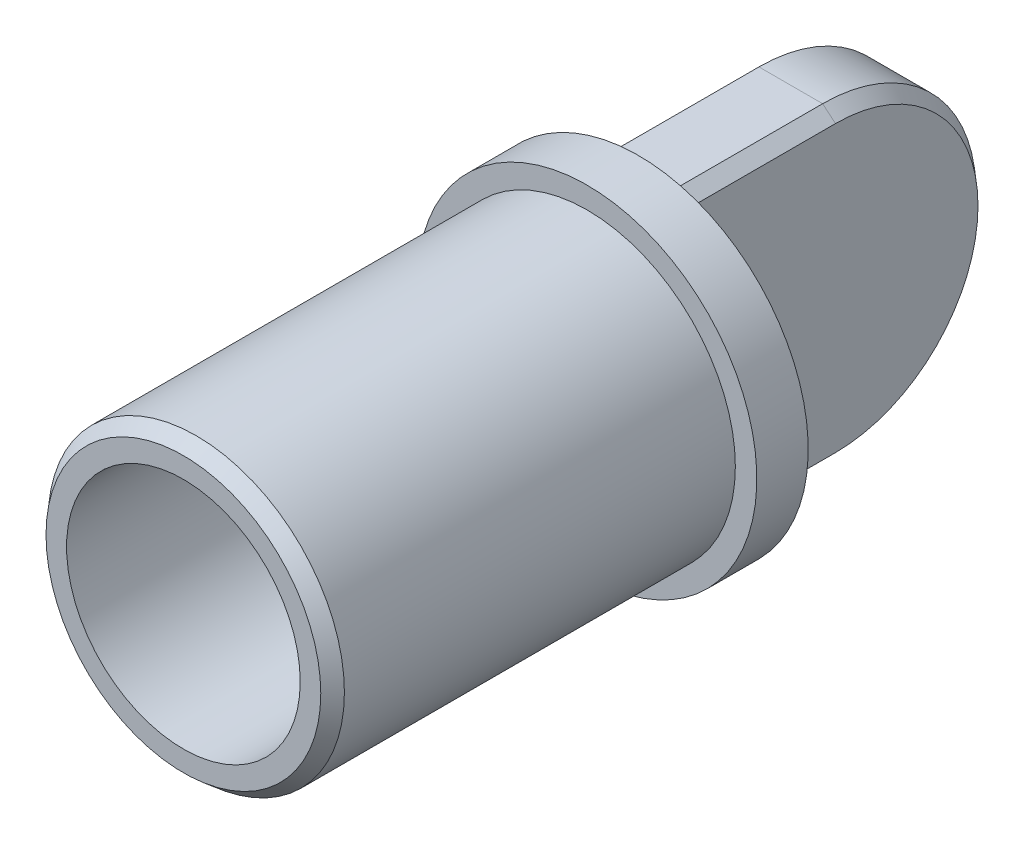
from build123d import *
from OCP.BRepFilletAPI import BRepFilletAPI_MakeChamfer

# Parameters (mm, degrees)
SKETCH1_R           = 7.325878031
EXTRUDE1_DEPTH      = 30.082981268
EXTRUDE4_DEPTH      = 32.817019656
EXTRUDE4_DEPTH_BACK = 32.817019656
SKETCH2_R           = 7.578564767
SKETCH2_5_R         = 7.578564767
EXTRUDE5_DEPTH      = 2.159
SKETCH3_R           = 8.388232563
EXTRUDE6_DEPTH      = 2.54
CHAMFER1_SIZE       = 0.635
CHAMFER1_SIZE2      = 0.532828266
CHAMFER2_SIZE       = 0.635
CHAMFER2_SIZE2      = 0.532828266
SKETCH4_R           = 5.776692344
EXTRUDE7_DEPTH      = 19.964416501


with BuildPart() as part:
    # Sketch1 → Extrude1 (new body)
    with BuildSketch(Plane.XY):
        with Locations(Location((0, 0, 0), (0, 0, 180))):
            Circle(SKETCH1_R)
    extrude(amount=EXTRUDE1_DEPTH)

    # Sketch2 → Extrude4 (cut, two sides: drawn at the far end of the back side and taken through both)
    with BuildSketch(Plane(origin=(0, 0, 0), x_dir=(0, 0, -1), z_dir=(1, 0, 0)).offset(-EXTRUDE4_DEPTH_BACK)):
        Circle(SKETCH2_R)
        with BuildLine():
            ThreePointArc((-7.578564767, 0), (-5.358854538, 5.358854538), (0, 7.578564767))
            Line((0, 7.578564767), (-7.578564767, 7.578564767))
            Line((-7.578564767, 7.578564767), (-7.578564767, 0))
        make_face()
        with BuildLine():
            ThreePointArc((0, -7.578564767), (-5.358854538, -5.358854538), (-7.578564767, 0))
            Line((-7.578564767, 0), (-7.578564767, -7.578564767))
            Line((-7.578564767, -7.578564767), (0, -7.578564767))
        make_face()
    extrude(amount=EXTRUDE4_DEPTH + EXTRUDE4_DEPTH_BACK, mode=Mode.SUBTRACT)

    # Sketch2<5> → Extrude5 (add, symmetric)
    with BuildSketch(Plane(origin=(0, 0, 0), x_dir=(0, 0, -1), z_dir=(1, 0, 0))):
        with BuildLine():
            ThreePointArc((-7.578564767, 0), (-5.358854538, 5.358854538), (0, 7.578564767))
            Line((0, 7.578564767), (-7.578564767, 7.578564767))
            Line((-7.578564767, 7.578564767), (-7.578564767, 0))
        make_face()
        Circle(SKETCH2_5_R)
        with BuildLine():
            ThreePointArc((0, -7.578564767), (-5.358854538, -5.358854538), (-7.578564767, 0))
            Line((-7.578564767, 0), (-7.578564767, -7.578564767))
            Line((-7.578564767, -7.578564767), (0, -7.578564767))
        make_face()
    extrude(amount=EXTRUDE5_DEPTH, both=True)

    # Sketch3 → Extrude6 (add)
    with BuildSketch(Plane(origin=(0, 0, 7.578564767), x_dir=(-1, 0, 0), z_dir=(0, 0, -1))):
        Circle(SKETCH3_R)
    extrude(amount=-EXTRUDE6_DEPTH)

    # Chamfer1: one chamfer whose edges measure the first distance from different faces: ONE call of the kernel's chamfer builder (chamfer() names one face for all edges)
    chamfer1_edges_1 = [part.edges().sort_by_distance(p)[0] for p in [
        (-2.159, -7.578564767, 3.789282384),
        (-2.159, 0, -7.578564767),
        (-2.159, 7.578564767, 3.789282384),
    ]]
    chamfer1_side_1 = [part.faces().sort_by_distance(p)[0] for p in [
        (-2.159, 0, 0.707457952),
    ]]
    chamfer1_edges_2 = [part.edges().sort_by_distance(p)[0] for p in [
        (2.159, -7.578564767, 3.789282384),
    ]]
    chamfer1_side_2 = [part.faces().sort_by_distance(p)[0] for p in [
        (0, -7.578564767, 3.789282384),
    ]]
    chamfer1_edges_3 = [part.edges().sort_by_distance(p)[0] for p in [
        (2.159, 0, -7.578564767),
    ]]
    chamfer1_side_3 = [part.faces().sort_by_distance(p)[0] for p in [
        (0, 0, -7.578564767),
    ]]
    chamfer1_edges_4 = [part.edges().sort_by_distance(p)[0] for p in [
        (2.159, 7.578564767, 3.789282384),
    ]]
    chamfer1_side_4 = [part.faces().sort_by_distance(p)[0] for p in [
        (0, 7.578564767, 3.789282384),
    ]]
    chamfer1 = BRepFilletAPI_MakeChamfer(part.part.solid().wrapped)
    for e in chamfer1_edges_1:
        chamfer1.Add(CHAMFER1_SIZE, CHAMFER1_SIZE2, e.wrapped, chamfer1_side_1[0].wrapped)  # the first distance lies on this face
    for e in chamfer1_edges_2:
        chamfer1.Add(CHAMFER1_SIZE, CHAMFER1_SIZE2, e.wrapped, chamfer1_side_2[0].wrapped)  # the first distance lies on this face
    for e in chamfer1_edges_3:
        chamfer1.Add(CHAMFER1_SIZE, CHAMFER1_SIZE2, e.wrapped, chamfer1_side_3[0].wrapped)  # the first distance lies on this face
    for e in chamfer1_edges_4:
        chamfer1.Add(CHAMFER1_SIZE, CHAMFER1_SIZE2, e.wrapped, chamfer1_side_4[0].wrapped)  # the first distance lies on this face
    add(Compound.cast(chamfer1.Shape()), mode=Mode.REPLACE)

    # Chamfer2
    chamfer2_edges = [part.edges().sort_by_distance(p)[0] for p in [
        (7.325878031, 0, 30.082981268),
    ]]
    chamfer2_side = [part.faces().sort_by_distance(p)[0] for p in [
        (7.325878031, 0, 20.100773018),
    ]]
    chamfer(chamfer2_edges, length=CHAMFER2_SIZE, length2=CHAMFER2_SIZE2, reference=chamfer2_side[0])

    # Sketch4 → Extrude7 (cut)
    with BuildSketch(Plane.XY.offset(30.082981268)):
        Circle(SKETCH4_R)
    extrude(amount=-EXTRUDE7_DEPTH, mode=Mode.SUBTRACT)


solid = part.part
